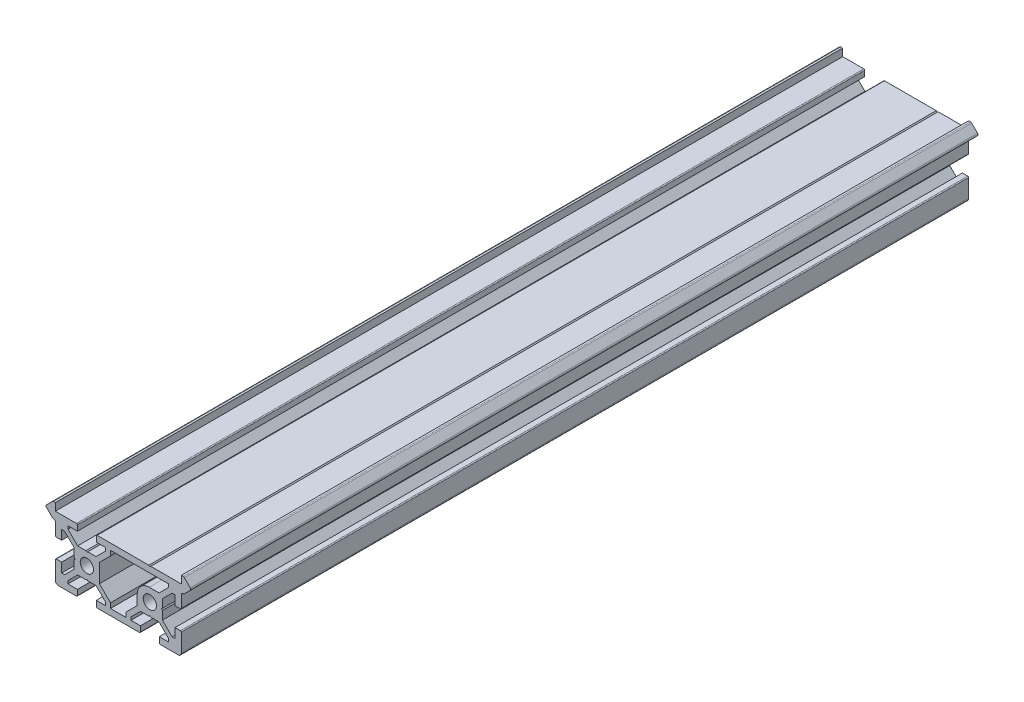
from build123d import *

# Parameters (mm, degrees)
MODEL_R             = 2.100000001
BOSS_EXTRUDE1_DEPTH = 250


with BuildPart() as part:
    # Model → Boss-Extrude1 (new body)
    with BuildSketch(Plane.XY):
        with BuildLine():
            Line((28.771485975, 48.105572105), (30.646485975, 49.980572105))
            ThreePointArc((30.646485975, 49.980572105), (30.808697649, 50.08895848), (31.000039365, 50.127018713))
            Line((31.000039365, 50.127018713), (31.592932584, 50.127018713))
            Line((31.592932584, 50.127018713), (31.592932584, 47.752018713))
            Line((31.592932584, 47.752018713), (38.292932585, 47.752018713))
            ThreePointArc((38.292932585, 47.752018713), (38.505064619, 47.664150748), (38.592932584, 47.452018714))
            Line((38.592932584, 47.452018714), (38.592932584, 45.752018713))
            Line((38.592932584, 45.752018713), (35.592932585, 45.752018713))
            Line((35.592932585, 45.752018713), (35.592932585, 44.812678885))
            Line((35.592932585, 44.812678885), (38.653592756, 41.752018713))
            Line((38.653592756, 41.752018713), (41.292932583, 41.752018713))
            Line((41.292932583, 41.752018713), (41.592932584, 41.452018713))
            Line((41.592932584, 41.452018713), (41.892932586, 41.752018714))
            Line((41.892932586, 41.752018714), (44.532272412, 41.752018714))
            Line((44.532272412, 41.752018714), (47.592932584, 44.812678886))
            Line((47.592932584, 44.812678886), (47.592932584, 45.752018714))
            Line((47.592932584, 45.752018714), (44.592932584, 45.752018714))
            Line((44.592932584, 45.752018714), (44.592932584, 47.452018715))
            ThreePointArc((44.592932584, 47.452018715), (44.68080055, 47.664150749), (44.892932584, 47.752018715))
            Line((44.892932584, 47.752018715), (61.292932583, 47.752018715))
            Line((61.292932583, 47.752018715), (61.592932582, 47.452018715))
            Line((61.592932582, 47.452018715), (61.892932583, 47.752018716))
            Line((61.892932583, 47.752018716), (71.592932583, 47.752018716))
            Line((71.592932583, 47.752018716), (71.592932583, 50.127018711))
            Line((71.592932583, 50.127018711), (72.185825802, 50.127018711))
            ThreePointArc((72.185825802, 50.127018711), (72.377167518, 50.088958477), (72.539379192, 49.980572102))
            Line((72.539379192, 49.980572102), (74.414379192, 48.105572102))
            ThreePointArc((74.414379192, 48.105572102), (74.560825801, 47.752018712), (74.414379192, 47.398465322))
            Line((74.414379192, 47.398465322), (72.539379192, 45.523465322))
            ThreePointArc((72.539379192, 45.523465322), (72.377167518, 45.415078947), (72.185825802, 45.377018714))
            Line((72.185825802, 45.377018714), (72.092932582, 45.377018714))
            ThreePointArc((72.092932582, 45.377018714), (71.739379192, 45.230572103), (71.592932583, 44.877018713))
            Line((71.592932583, 44.877018713), (71.592932583, 41.052018712))
            ThreePointArc((71.592932583, 41.052018712), (71.505064617, 40.839886678), (71.292932581, 40.752018713))
            Line((71.292932581, 40.752018713), (69.592932583, 40.752018713))
            Line((69.592932583, 40.752018713), (69.592932583, 43.752018712))
            Line((69.592932583, 43.752018712), (68.653592755, 43.752018712))
            Line((68.653592755, 43.752018712), (65.592932583, 40.691358541))
            Line((65.592932583, 40.691358541), (65.592932583, 38.052018712))
            Line((65.592932583, 38.052018712), (65.292932584, 37.752018712))
            Line((65.292932584, 37.752018712), (65.592932583, 37.452018713))
            Line((65.592932583, 37.452018713), (65.592932583, 34.812678884))
            Line((65.592932583, 34.812678884), (68.653592755, 31.752018712))
            Line((68.653592755, 31.752018712), (69.592932583, 31.752018712))
            Line((69.592932583, 31.752018712), (69.592932583, 34.752018711))
            Line((69.592932583, 34.752018711), (71.292932581, 34.752018711))
            ThreePointArc((71.292932581, 34.752018711), (71.505064617, 34.664150747), (71.592932583, 34.452018712))
            Line((71.592932583, 34.452018712), (71.592932583, 28.75201871))
            ThreePointArc((71.592932583, 28.75201871), (71.300039364, 28.044911929), (70.592932582, 27.752018711))
            Line((70.592932582, 27.752018711), (64.892932582, 27.752018711))
            ThreePointArc((64.892932582, 27.752018711), (64.680800548, 27.839886676), (64.592932583, 28.05201871))
            Line((64.592932583, 28.05201871), (64.592932583, 29.752018711))
            Line((64.592932583, 29.752018711), (67.592932582, 29.752018711))
            Line((67.592932582, 29.752018711), (67.592932582, 30.69135854))
            Line((67.592932582, 30.69135854), (64.532272411, 33.752018711))
            Line((64.532272411, 33.752018711), (61.892932584, 33.752018711))
            Line((61.892932584, 33.752018711), (61.592932582, 34.052018713))
            Line((61.592932582, 34.052018713), (61.292932582, 33.752018712))
            Line((61.292932582, 33.752018712), (58.653592755, 33.752018712))
            Line((58.653592755, 33.752018712), (55.592932583, 30.691358541))
            Line((55.592932583, 30.691358541), (55.592932583, 29.752018713))
            Line((55.592932583, 29.752018713), (58.592932583, 29.752018713))
            Line((58.592932583, 29.752018713), (58.592932583, 28.052018712))
            ThreePointArc((58.592932583, 28.052018712), (58.505064617, 27.839886678), (58.292932583, 27.752018712))
            Line((58.292932583, 27.752018712), (44.892932584, 27.752018712))
            ThreePointArc((44.892932584, 27.752018712), (44.68080055, 27.839886678), (44.592932584, 28.052018712))
            Line((44.592932584, 28.052018712), (44.592932584, 29.752018713))
            Line((44.592932584, 29.752018713), (47.592932584, 29.752018713))
            Line((47.592932584, 29.752018713), (47.592932584, 30.691358541))
            Line((47.592932584, 30.691358541), (44.532272412, 33.752018712))
            Line((44.532272412, 33.752018712), (41.892932586, 33.752018712))
            Line((41.892932586, 33.752018712), (41.592932584, 34.052018714))
            Line((41.592932584, 34.052018714), (41.292932583, 33.752018714))
            Line((41.292932583, 33.752018714), (38.653592756, 33.752018714))
            Line((38.653592756, 33.752018714), (35.592932585, 30.691358542))
            Line((35.592932585, 30.691358542), (35.592932585, 29.752018714))
            Line((35.592932585, 29.752018714), (38.592932584, 29.752018714))
            Line((38.592932584, 29.752018714), (38.592932584, 28.052018713))
            ThreePointArc((38.592932584, 28.052018713), (38.505064619, 27.839886679), (38.292932585, 27.752018714))
            Line((38.292932585, 27.752018714), (32.592932585, 27.752018714))
            ThreePointArc((32.592932585, 27.752018714), (31.885825803, 28.044911931), (31.592932584, 28.752018713))
            Line((31.592932584, 28.752018713), (31.592932584, 34.452018715))
            ThreePointArc((31.592932584, 34.452018715), (31.68080055, 34.664150748), (31.892932583, 34.752018714))
            Line((31.892932583, 34.752018714), (33.592932584, 34.752018714))
            Line((33.592932584, 34.752018714), (33.592932584, 31.752018715))
            Line((33.592932584, 31.752018715), (34.532272412, 31.752018715))
            Line((34.532272412, 31.752018715), (37.592932584, 34.812678886))
            Line((37.592932584, 34.812678886), (37.592932584, 37.452018715))
            Line((37.592932584, 37.452018715), (37.892932583, 37.752018715))
            Line((37.892932583, 37.752018715), (37.592932584, 38.052018714))
            Line((37.592932584, 38.052018714), (37.592932584, 40.691358543))
            Line((37.592932584, 40.691358543), (34.532272412, 43.752018715))
            Line((34.532272412, 43.752018715), (33.592932584, 43.752018715))
            Line((33.592932584, 43.752018715), (33.592932584, 40.752018716))
            Line((33.592932584, 40.752018716), (31.892932586, 40.752018716))
            ThreePointArc((31.892932586, 40.752018716), (31.68080055, 40.83988668), (31.592932584, 41.052018715))
            Line((31.592932584, 41.052018715), (31.592932584, 44.877018715))
            ThreePointArc((31.592932584, 44.877018715), (31.446485975, 45.230572106), (31.092932585, 45.377018716))
            Line((31.092932585, 45.377018716), (31.000039365, 45.377018716))
            ThreePointArc((31.000039365, 45.377018716), (30.808697649, 45.41507895), (30.646485975, 45.523465324))
            Line((30.646485975, 45.523465324), (28.771485975, 47.398465325))
            ThreePointArc((28.771485975, 47.398465325), (28.625039366, 47.752018715), (28.771485975, 48.105572105))
        make_face()
        with Locations((61.592932582, 37.752018715)):
            Circle(MODEL_R, mode=Mode.SUBTRACT)
        with Locations((41.592932582, 37.752018715)):
            Circle(MODEL_R, mode=Mode.SUBTRACT)
        with BuildLine():
            Line((54.092932584, 29.752018715), (49.092932584, 29.752018715))
            Line((49.092932584, 29.752018715), (49.092932584, 31.312678886))
            Line((49.092932584, 31.312678886), (45.592932583, 34.812678886))
            Line((45.592932583, 34.812678886), (45.592932583, 40.691358543))
            Line((45.592932583, 40.691358543), (49.092932584, 44.191358544))
            Line((49.092932584, 44.191358544), (49.092932584, 45.752018714))
            Line((49.092932584, 45.752018714), (67.592932582, 45.752018714))
            Line((67.592932582, 45.752018714), (67.592932582, 44.812678887))
            Line((67.592932582, 44.812678887), (64.532272411, 41.752018716))
            Line((64.532272411, 41.752018716), (61.402932584, 41.752018716))
            ThreePointArc((61.402932584, 41.752018716), (58.708855747, 40.636095552), (57.592932584, 37.942018716))
            Line((57.592932584, 37.942018716), (57.592932584, 34.812678886))
            Line((57.592932584, 34.812678886), (54.092932584, 31.312678886))
            Line((54.092932584, 31.312678886), (54.092932584, 29.752018715))
        make_face(mode=Mode.SUBTRACT)
    extrude(amount=BOSS_EXTRUDE1_DEPTH)


solid = part.part
